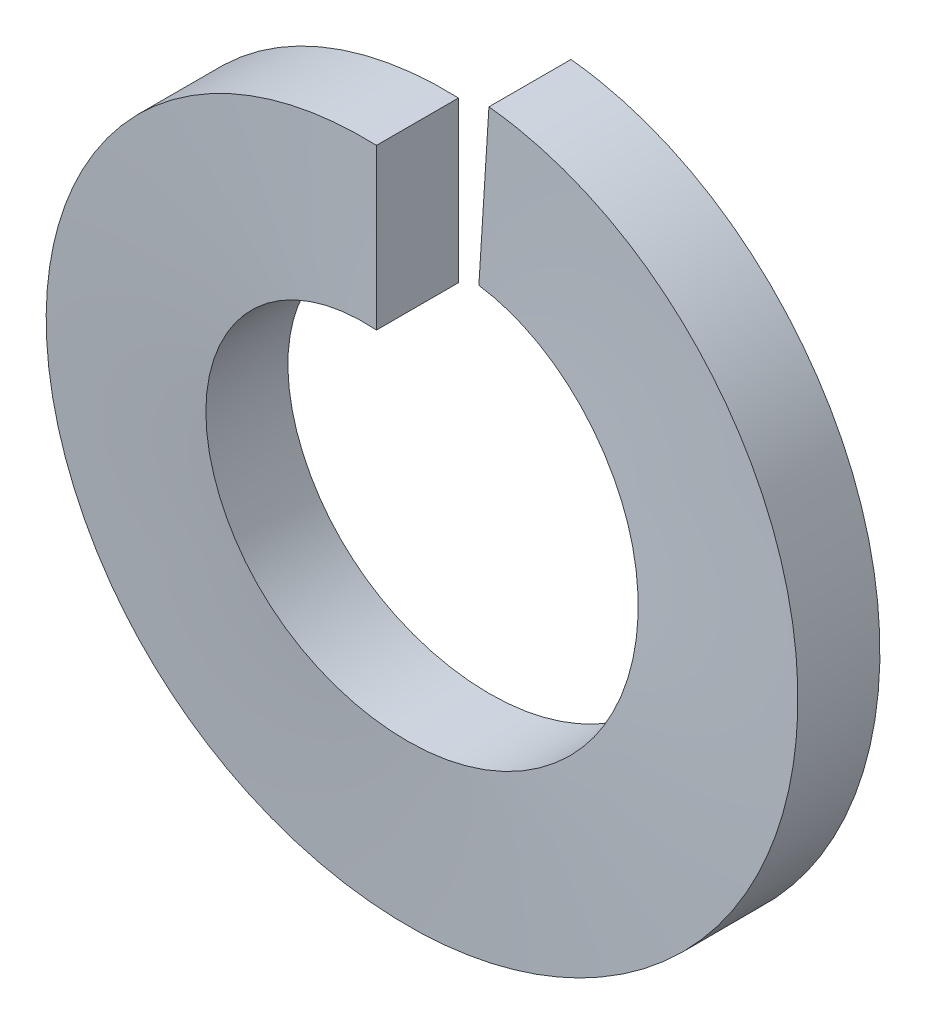
from build123d import *

# Parameters (mm, degrees)
SWEEP1_PITCH       = 0.564444444
SWEEP1_HEIGHT      = 0.5588
SWEEP1_RADIUS      = 2.1844
SWEEP1_START_ANGLE = 90
SKETCH2_W          = 0.508
SKETCH2_H          = 0.9906


with BuildPart() as part:
    # Sweep1: sweep along a helix
    with BuildLine() as sweep1_path:
        add(Helix(SWEEP1_PITCH, SWEEP1_HEIGHT, SWEEP1_RADIUS, center=(0, 0, 0), direction=(0, 0, -1), lefthand=True, mode=Mode.PRIVATE).rotate(Axis((0, 0, 0), (0, 0, -1)), SWEEP1_START_ANGLE))
    # Sketch2 → Sweep1 (sweep)
    with BuildSketch(Plane(origin=(0, 0, 0), x_dir=(0, 0, -1), z_dir=(1, 0, 0))):
        with Locations((-0.254, 1.6891)):
            Rectangle(SKETCH2_W, SKETCH2_H)
    sweep(path=sweep1_path.line, is_frenet=True)


solid = part.part
